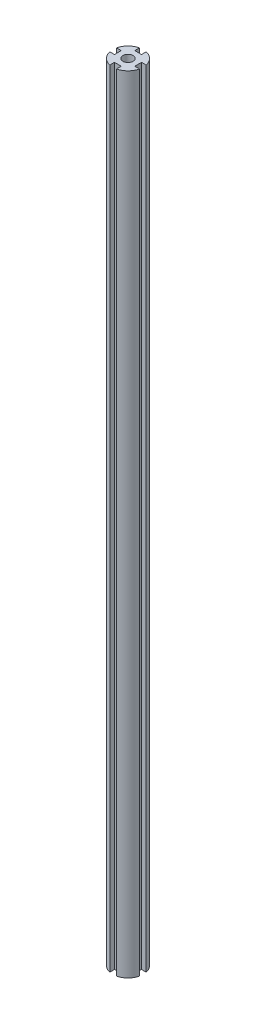
from build123d import *

# Parameters (mm, degrees)
SKETCH1_R                 = 4.5
BOSS_EXTRUDE1_DEPTH       = 232
F_3_0MM_DOWEL_HOLE1_D     = 3
F_3_0MM_DOWEL_HOLE1_DEPTH = 3
F_3_0MM_DOWEL_HOLE1_TIP   = 0.901290929
F_3_0MM_DOWEL_HOLE2_D     = 3
F_3_0MM_DOWEL_HOLE2_DEPTH = 3
F_3_0MM_DOWEL_HOLE2_TIP   = 0.901290929
SKETCH6_W                 = 2
SKETCH6_H                 = 2
CUT_EXTRUDE1_DEPTH        = 233.08726807
CIRPATTERN1_COUNT         = 4


with BuildPart() as part:
    # Sketch1 → Boss-Extrude1 (new body)
    with BuildSketch(Plane(origin=(0, 0, 0), x_dir=(1, 0, 0), z_dir=(0, 1, 0))):
        with Locations(Location((0, 0, 0), (0, 0, 90))):
            Circle(SKETCH1_R)
    extrude(amount=BOSS_EXTRUDE1_DEPTH)

    # Ø3.0mm Dowel Hole1
    with Locations(Plane.XZ):
        with Locations((0, 0)):
            Hole(F_3_0MM_DOWEL_HOLE1_D / 2, depth=F_3_0MM_DOWEL_HOLE1_DEPTH)
            with Locations((0, 0, -(F_3_0MM_DOWEL_HOLE1_DEPTH + F_3_0MM_DOWEL_HOLE1_TIP / 2))):  # 118° drill point
                Cone(0, F_3_0MM_DOWEL_HOLE1_D / 2, F_3_0MM_DOWEL_HOLE1_TIP, mode=Mode.SUBTRACT)

    # Ø3.0mm Dowel Hole2
    with Locations(Plane(origin=(0, 232, 0), x_dir=(1, 0, 0), z_dir=(0, 1, 0))):
        with Locations((0, 0)):
            Hole(F_3_0MM_DOWEL_HOLE2_D / 2, depth=F_3_0MM_DOWEL_HOLE2_DEPTH)
            with Locations((0, 0, -(F_3_0MM_DOWEL_HOLE2_DEPTH + F_3_0MM_DOWEL_HOLE2_TIP / 2))):  # 118° drill point
                Cone(0, F_3_0MM_DOWEL_HOLE2_D / 2, F_3_0MM_DOWEL_HOLE2_TIP, mode=Mode.SUBTRACT)

    # Sketch6 → Cut-Extrude1 (cut, through all)
    with BuildSketch(Plane(origin=(0, 232, 0), x_dir=(1, 0, 0), z_dir=(0, 1, 0))):
        with Locations((-4, 0)):
            Rectangle(SKETCH6_W, SKETCH6_H)
    cut_extrude1 = extrude(amount=-CUT_EXTRUDE1_DEPTH, mode=Mode.SUBTRACT)

    # CirPattern1: Cut-Extrude1 ×4 about axis
    cirpattern1_axis = Axis((0, 0, 0), (0, 1, 0))
    for i in range(1, CIRPATTERN1_COUNT):
        add(cut_extrude1.rotate(cirpattern1_axis, i * 360 / CIRPATTERN1_COUNT), mode=Mode.SUBTRACT)


solid = part.part
